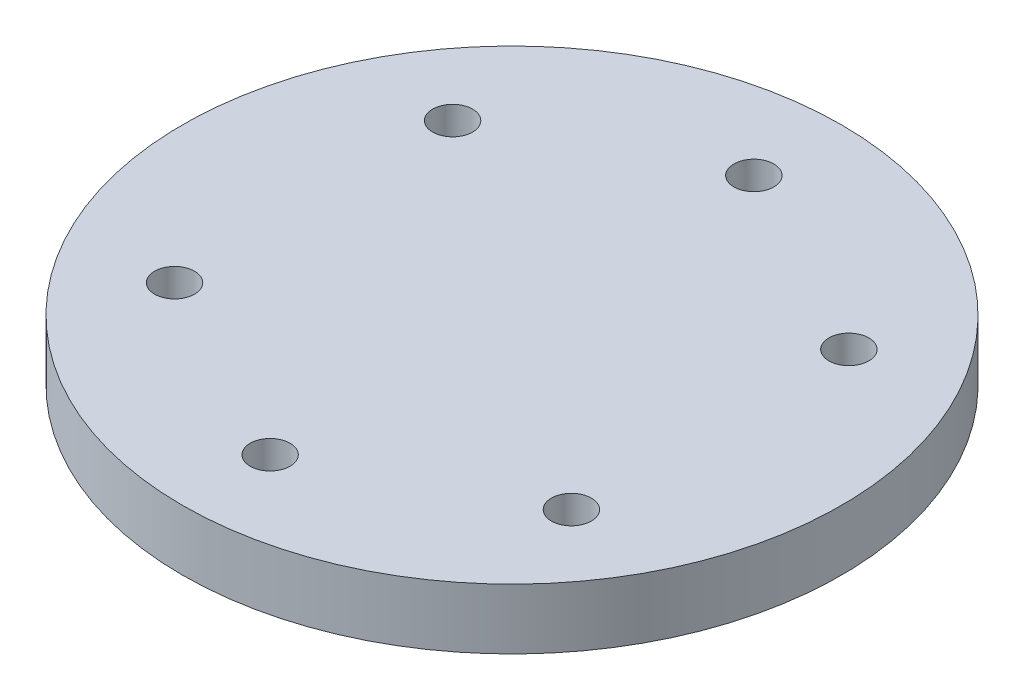
from build123d import *

# Parameters (mm, degrees)
SKETCH1_R           = 27.25
BOSS_EXTRUDE1_DEPTH = 5
SKETCH2_R           = 1.65
CUT_EXTRUDE1_DEPTH  = 10


with BuildPart() as part:
    # Sketch1 → Boss-Extrude1 (new body)
    with BuildSketch(Plane(origin=(0, 0, 0), x_dir=(1, 0, 0), z_dir=(0, 1, 0))):
        with Locations(Location((0, 0, 0), (0, 0, 270))):
            Circle(SKETCH1_R)
    extrude(amount=BOSS_EXTRUDE1_DEPTH)

    # Sketch2 → Cut-Extrude1 (cut)
    with BuildSketch(Plane(origin=(0, 5, 0), x_dir=(1, 0, 0), z_dir=(0, 1, 0))):
        with Locations(Location((0, 20, 0), (0, 0, 270))):
            Circle(SKETCH2_R)
        with Locations(Location((-16.383040886, 11.471528727, 0), (0, 0, 270))):
            Circle(SKETCH2_R)
        with Locations(Location((16.383040886, 11.471528727, 0), (0, 0, 270))):
            Circle(SKETCH2_R)
        with Locations(Location((16.383040886, -11.471528727, 0), (0, 0, 270))):
            Circle(SKETCH2_R)
        with Locations(Location((0, -20, 0), (0, 0, 270))):
            Circle(SKETCH2_R)
        with Locations(Location((-16.27093552, -11.629989565, 0), (0, 0, 270))):
            Circle(SKETCH2_R)
    extrude(amount=-CUT_EXTRUDE1_DEPTH, mode=Mode.SUBTRACT)


solid = part.part
